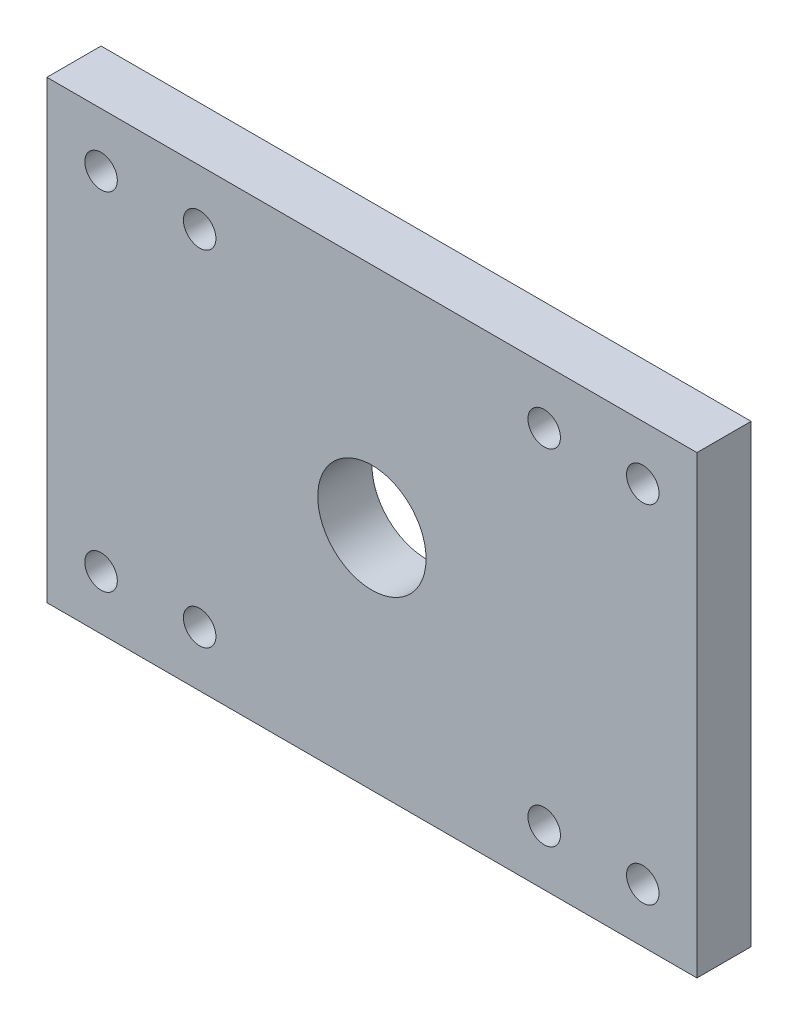
from build123d import *

# Parameters (mm, degrees)
SKETCH1_W           = 60
SKETCH1_H           = 42
SKETCH1_R           = 1.5
SKETCH1_R_2         = 5
BOSS_EXTRUDE1_DEPTH = 5
SKETCH3_R           = 2.625
CUT_EXTRUDE4_DEPTH  = 2.5


with BuildPart() as part:
    # Sketch1 → Boss-Extrude1 (new body)
    with BuildSketch(Plane.XY):
        Rectangle(SKETCH1_W, SKETCH1_H)
        with Locations((-15.9, 15.9)):
            Circle(SKETCH1_R, mode=Mode.SUBTRACT)
        with Locations((15.9, 15.9)):
            Circle(SKETCH1_R, mode=Mode.SUBTRACT)
        with Locations((15.9, -15.9)):
            Circle(SKETCH1_R, mode=Mode.SUBTRACT)
        with Locations((-15.9, -15.9)):
            Circle(SKETCH1_R, mode=Mode.SUBTRACT)
        with Locations((-25, 16)):
            Circle(SKETCH1_R, mode=Mode.SUBTRACT)
        Circle(SKETCH1_R_2, mode=Mode.SUBTRACT)
        with Locations((25, 16)):
            Circle(SKETCH1_R, mode=Mode.SUBTRACT)
        with Locations((25, -16)):
            Circle(SKETCH1_R, mode=Mode.SUBTRACT)
        with Locations((-25, -16)):
            Circle(SKETCH1_R, mode=Mode.SUBTRACT)
    extrude(amount=BOSS_EXTRUDE1_DEPTH)

    # Sketch3 → Cut-Extrude4 (cut)
    with BuildSketch(Plane(origin=(0, 0, 0), x_dir=(-1, 0, 0), z_dir=(0, 0, -1))):
        with Locations((-15.9, 15.9)):
            Circle(SKETCH3_R)
        with Locations((15.9, 15.9)):
            Circle(SKETCH3_R)
        with Locations((15.9, -15.9)):
            Circle(SKETCH3_R)
        with Locations((-15.9, -15.9)):
            Circle(SKETCH3_R)
    extrude(amount=-CUT_EXTRUDE4_DEPTH, mode=Mode.SUBTRACT)


solid = part.part
